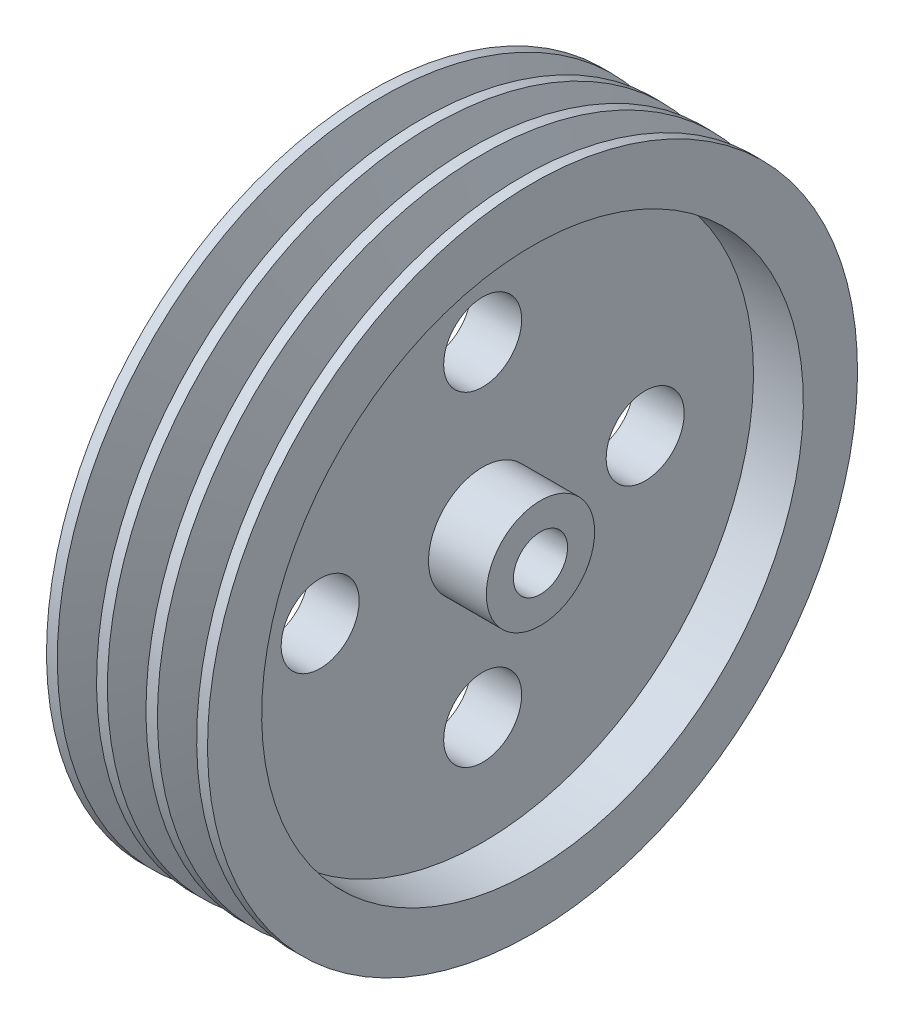
from build123d import *

# Parameters (mm, degrees)
CUT_EXTRUDE1_REACH = 5545.523
SKETCH2_R          = 457.2


with BuildPart() as part:
    # Sketch1 → Revolve1 (revolve)
    with BuildSketch(Plane.XY, mode=Mode.PRIVATE) as revolve1_sk:
        Polygon((0, 317.5), (0, 635), (711.2, 635), (711.2, 3175), (0, 3175), (0, 3810), (127, 3810), (293.407191107, 3352.8), (420.407191107, 3352.8), (586.814382213, 3810), (713.814382213, 3810), (876.488852113, 3363.055567228), (1003.488852113, 3363.055567228), (1166.163322013, 3810), (1300.628764426, 3810), (1456.167620866, 3352.8), (1583.167620866, 3352.8), (1760.611792053, 3810), (1887.611792053, 3810), (1887.611792053, 3175), (1303.243146639, 3175), (1303.243146639, 635), (1981.2, 635), (1981.2, 317.5), align=None)
    revolve(revolve1_sk.sketch.rotate(Axis((0, 0, 0), (1, 0, 0)), 180), axis=Axis((0, 0, 0), (1, 0, 0)))

    # Sketch2 → Cut-Extrude1 (cut, up to next)
    with BuildSketch(Plane(origin=(1303.243146639, 0, 0), x_dir=(0, 0, -1), z_dir=(1, 0, 0)), mode=Mode.PRIVATE) as cut_extrude1_sk1:
        with Locations(Location((0, 1905, 0), (0, 0, 90))):
            Circle(SKETCH2_R)
    cut_extrude1_tool1 = extrude(cut_extrude1_sk1.sketch, amount=-CUT_EXTRUDE1_REACH, mode=Mode.PRIVATE) & part.part
    # Sketch2 → Cut-Extrude1 (cut, up to next)
    with BuildSketch(Plane(origin=(1303.243146639, 0, 0), x_dir=(0, 0, -1), z_dir=(1, 0, 0)), mode=Mode.PRIVATE) as cut_extrude1_sk2:
        with Locations(Location((0, -1905, 0), (0, 0, 90))):
            Circle(SKETCH2_R)
    cut_extrude1_tool2 = extrude(cut_extrude1_sk2.sketch, amount=-CUT_EXTRUDE1_REACH, mode=Mode.PRIVATE) & part.part
    # Sketch2 → Cut-Extrude1 (cut, up to next)
    with BuildSketch(Plane(origin=(1303.243146639, 0, 0), x_dir=(0, 0, -1), z_dir=(1, 0, 0)), mode=Mode.PRIVATE) as cut_extrude1_sk3:
        with Locations(Location((1905, 0, 0), (0, 0, 90))):
            Circle(SKETCH2_R)
    cut_extrude1_tool3 = extrude(cut_extrude1_sk3.sketch, amount=-CUT_EXTRUDE1_REACH, mode=Mode.PRIVATE) & part.part
    # Sketch2 → Cut-Extrude1 (cut, up to next)
    with BuildSketch(Plane(origin=(1303.243146639, 0, 0), x_dir=(0, 0, -1), z_dir=(1, 0, 0)), mode=Mode.PRIVATE) as cut_extrude1_sk4:
        with Locations(Location((-1905, 0, 0), (0, 0, 90))):
            Circle(SKETCH2_R)
    cut_extrude1_tool4 = extrude(cut_extrude1_sk4.sketch, amount=-CUT_EXTRUDE1_REACH, mode=Mode.PRIVATE) & part.part
    add(cut_extrude1_tool1.solids().sort_by_distance((1303.243147, 1905, 0))[0], mode=Mode.SUBTRACT)
    add(cut_extrude1_tool2.solids().sort_by_distance((1303.243147, -1905, 0))[0], mode=Mode.SUBTRACT)
    add(cut_extrude1_tool3.solids().sort_by_distance((1303.243147, 0, -1905))[0], mode=Mode.SUBTRACT)
    add(cut_extrude1_tool4.solids().sort_by_distance((1303.243147, 0, 1905))[0], mode=Mode.SUBTRACT)


solid = part.part
